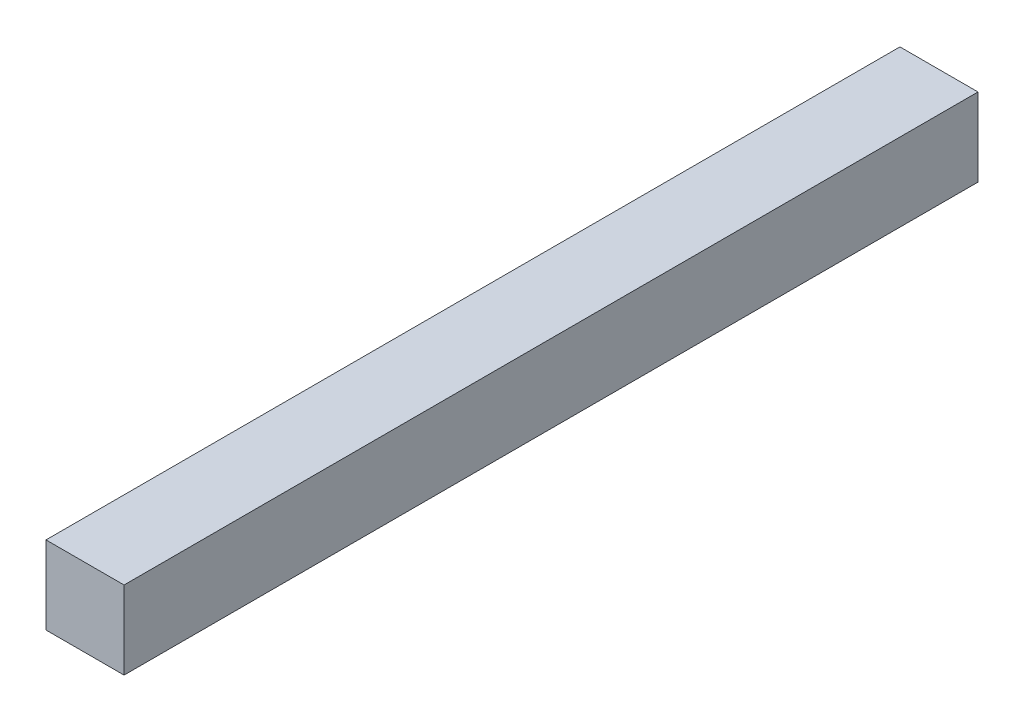
from build123d import *

# Parameters (mm, degrees)
SKETCH1_W           = 3.2
SKETCH1_H           = 3.2
BOSS_EXTRUDE1_DEPTH = 35


with BuildPart() as part:
    # Sketch1 → Boss-Extrude1 (new body)
    with BuildSketch(Plane.XY):
        Rectangle(SKETCH1_W, SKETCH1_H)
    extrude(amount=BOSS_EXTRUDE1_DEPTH)


solid = part.part
